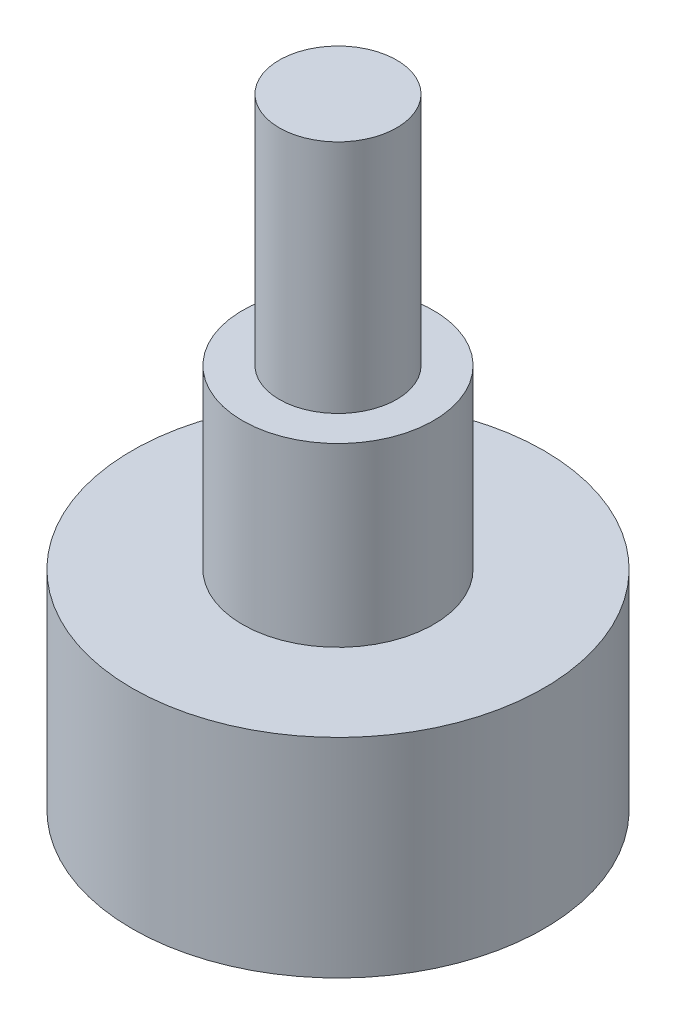
from build123d import *

# Parameters (mm, degrees)
SKETCH1_R           = 11.115
BOSS_EXTRUDE1_DEPTH = 11.25
SKETCH2_R           = 5.1585
BOSS_EXTRUDE2_DEPTH = 9.53
SKETCH3_R           = 3.171
BOSS_EXTRUDE3_DEPTH = 22.23


with BuildPart() as part:
    # Sketch1 → Boss-Extrude1 (new body)
    with BuildSketch(Plane(origin=(0, 0, 0), x_dir=(1, 0, 0), z_dir=(0, 1, 0))):
        with Locations(Location((0, 0, 0), (0, 0, 90))):
            Circle(SKETCH1_R)
    extrude(amount=BOSS_EXTRUDE1_DEPTH)

    # Sketch2 → Boss-Extrude2 (add)
    with BuildSketch(Plane(origin=(0, 11.25, 0), x_dir=(1, 0, 0), z_dir=(0, 1, 0))):
        with Locations(Location((0, 0, 0), (0, 0, 270))):
            Circle(SKETCH2_R)
    extrude(amount=BOSS_EXTRUDE2_DEPTH)

    # Sketch3 → Boss-Extrude3 (add)
    with BuildSketch(Plane(origin=(0, 11.25, 0), x_dir=(1, 0, 0), z_dir=(0, 1, 0))):
        with Locations(Location((0, 0, 0), (0, 0, 270))):
            Circle(SKETCH3_R)
    extrude(amount=BOSS_EXTRUDE3_DEPTH)


solid = part.part
